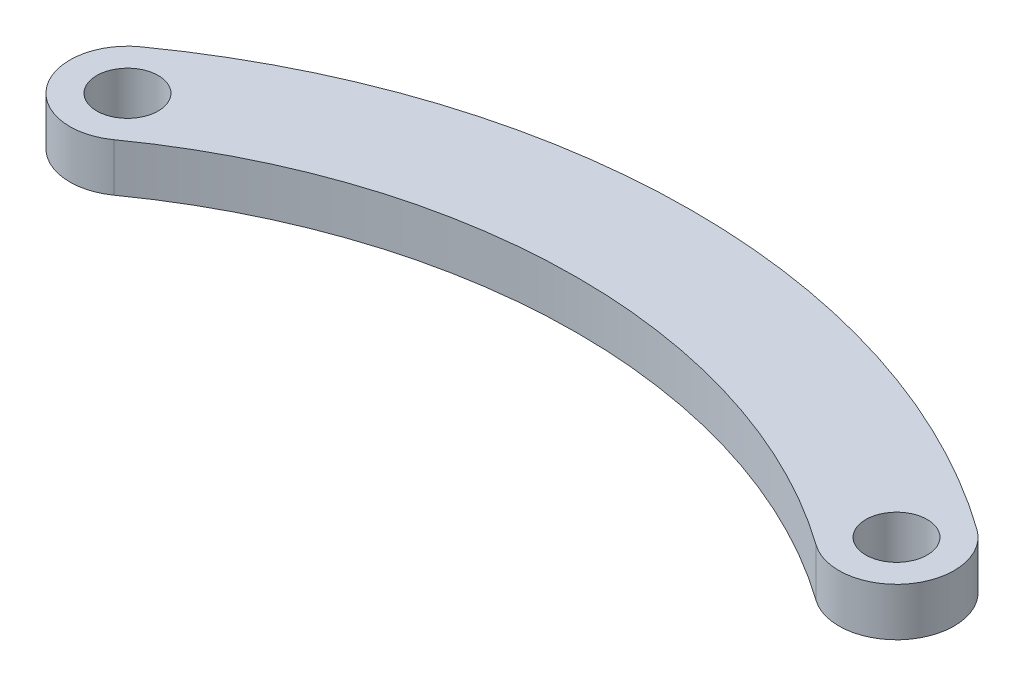
from build123d import *

# Parameters (mm, degrees)
SKETCH_1_R      = 1.6
EXTRUDE_1_DEPTH = 2.5


with BuildPart() as part:
    # 草图1 → 凸台-拉伸1 (new body)
    with BuildSketch(Plane(origin=(0, 0, 0), x_dir=(1, 0, 0), z_dir=(0, 1, 0))):
        with BuildLine():
            ThreePointArc((41.741363132, 2.442878311), (20, 9.398684787), (-1.741363132, 2.442878311))
            ThreePointArc((-1.741363132, 2.442878311), (-2.442878311, -1.741363132), (1.741363132, -2.442878311))
            ThreePointArc((1.741363132, -2.442878311), (20, 3.398684787), (38.258636868, -2.442878311))
            ThreePointArc((38.258636868, -2.442878311), (42.442878311, -1.741363132), (41.741363132, 2.442878311))
        make_face()
        Circle(SKETCH_1_R, mode=Mode.SUBTRACT)
        with Locations((40, 0)):
            Circle(SKETCH_1_R, mode=Mode.SUBTRACT)
    extrude(amount=EXTRUDE_1_DEPTH)


solid = part.part
